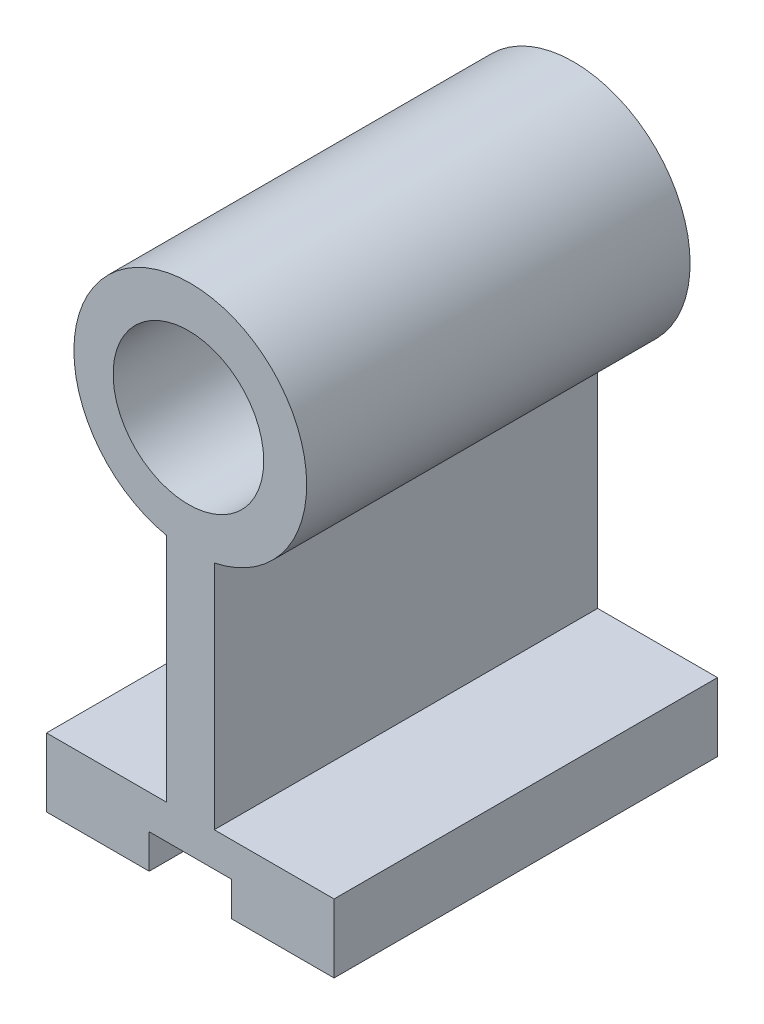
from build123d import *

# Parameters (mm, degrees)
SKETCH3_R           = 11
BOSS_EXTRUDE1_DEPTH = 56


with BuildPart() as part:
    # Sketch3 → Boss-Extrude1 (new body)
    with BuildSketch(Plane.XY):
        with BuildLine():
            Line((0, 0), (-15, 0))
            Line((-15, 0), (-15, 10))
            Line((-15, 10), (2.5, 10))
            Line((2.5, 10), (2.5, 43.750570873))
            ThreePointArc((2.5, 43.750570873), (6, 77.386375632), (9.5, 43.750570873))
            Line((9.5, 43.750570873), (9.5, 10))
            Line((9.5, 10), (27, 10))
            Line((27, 10), (27, 0))
            Line((27, 0), (12, 0))
            Line((12, 0), (12, 5))
            Line((12, 5), (0, 5))
            Line((0, 5), (0, 0))
        make_face()
        with Locations((5.728023625, 60.256681192)):
            Circle(SKETCH3_R, mode=Mode.SUBTRACT)
    extrude(amount=BOSS_EXTRUDE1_DEPTH)


solid = part.part
